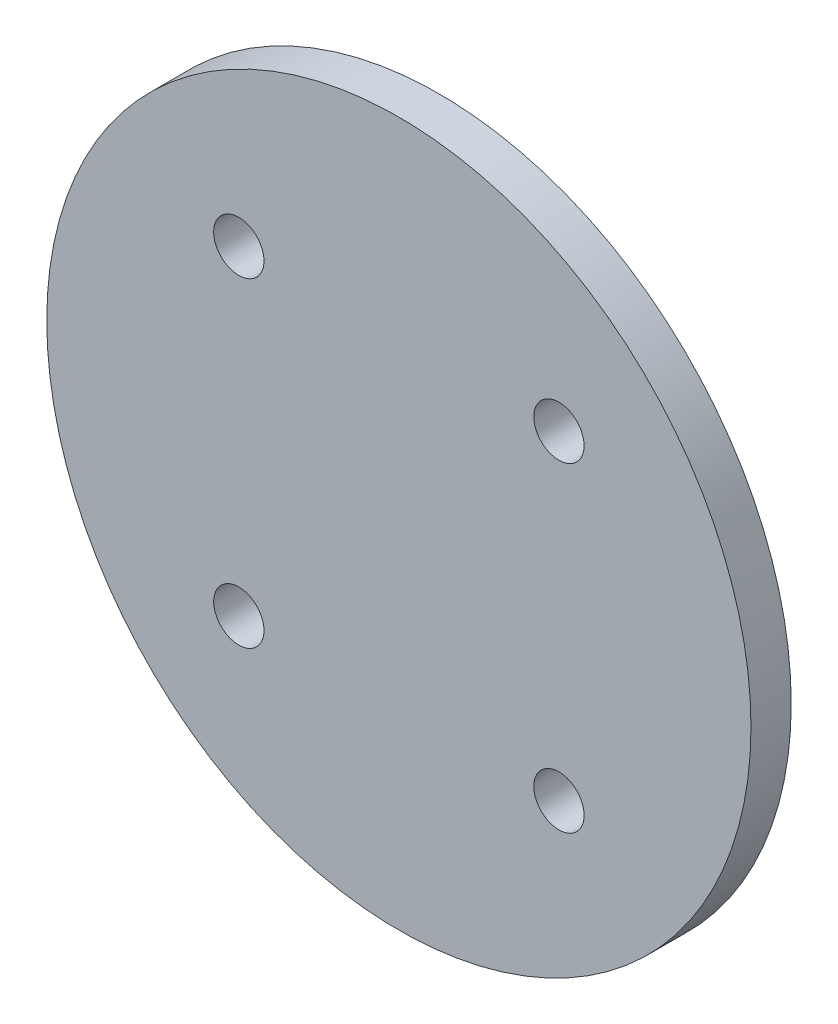
from build123d import *

# Parameters (mm, degrees)
SKETCH1_R           = 35
SKETCH1_R_2         = 2.5
BOSS_EXTRUDE1_DEPTH = 4


with BuildPart() as part:
    # Sketch1 → Boss-Extrude1 (new body)
    with BuildSketch(Plane.XY):
        Circle(SKETCH1_R)
        with Locations((15.909902577, 15.909902577)):
            Circle(SKETCH1_R_2, mode=Mode.SUBTRACT)
        with Locations((15.909902577, -15.909902577)):
            Circle(SKETCH1_R_2, mode=Mode.SUBTRACT)
        with Locations((-15.909902577, -15.909902577)):
            Circle(SKETCH1_R_2, mode=Mode.SUBTRACT)
        with Locations((-15.909902577, 15.909902577)):
            Circle(SKETCH1_R_2, mode=Mode.SUBTRACT)
    extrude(amount=BOSS_EXTRUDE1_DEPTH)


solid = part.part
